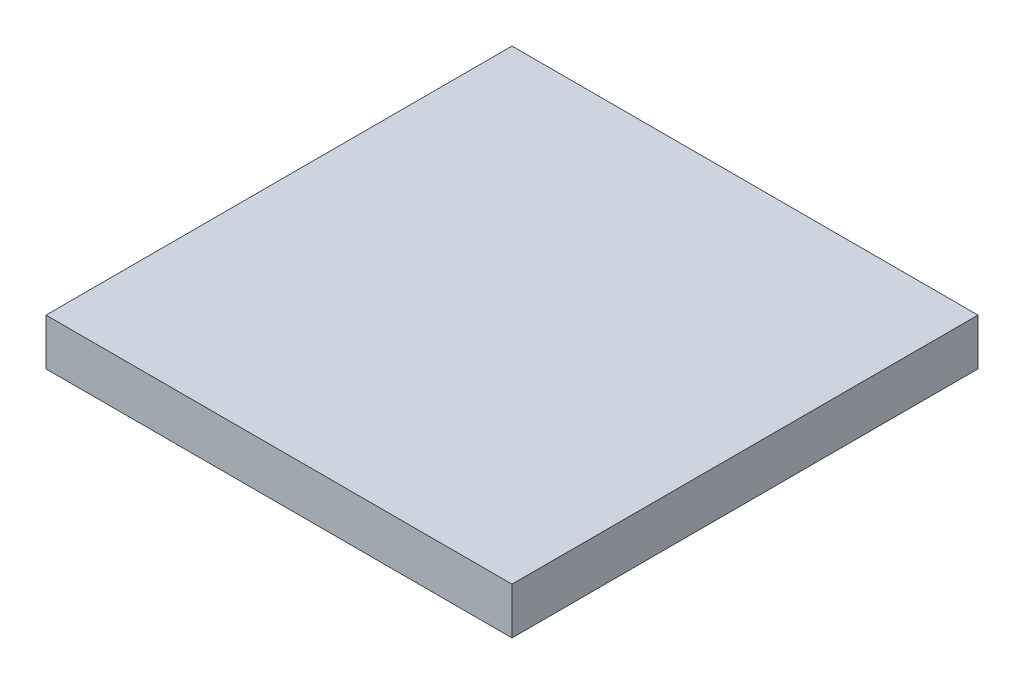
from build123d import *

# Parameters (mm, degrees)
SKETCH1_W           = 100
SKETCH1_H           = 100
BOSS_EXTRUDE2_DEPTH = 10


with BuildPart() as part:
    # Sketch1 → Boss-Extrude2 (new body)
    with BuildSketch(Plane(origin=(0, 0, 0), x_dir=(1, 0, 0), z_dir=(0, 1, 0))):
        with Locations((50, 50)):
            Rectangle(SKETCH1_W, SKETCH1_H)
    extrude(amount=BOSS_EXTRUDE2_DEPTH)


solid = part.part
